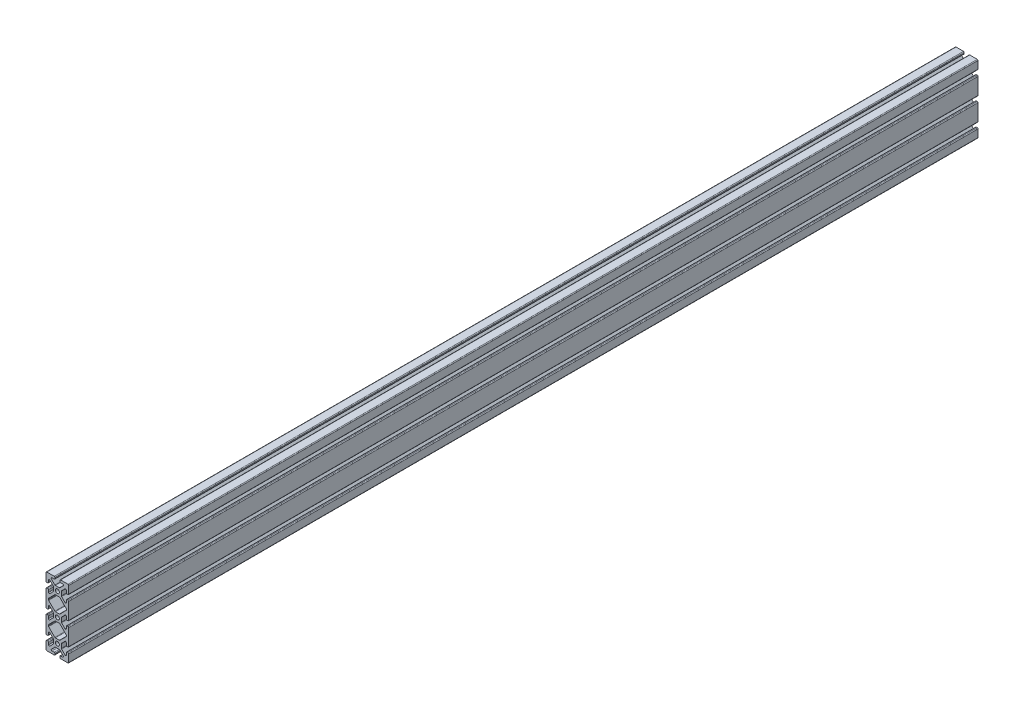
from build123d import *

# Parameters (mm, degrees)
SKETCH1_R           = 3.3274
BOSS_EXTRUDE1_DEPTH = 1524
FILLET1_R           = 1.27


with BuildPart() as part:
    # Sketch1 → Boss-Extrude1 (new body)
    with BuildSketch(Plane.XY):
        Polygon((-12.112318041, 14.986), (-3.882718041, 6.7564), (3.882718041, 6.7564), (12.112318041, 14.986), (4.064, 14.986), (4.064, 19.05), (19.05, 19.05), (19.05, 4.064), (14.986, 4.064), (14.986, 12.112318041), (6.7564, 3.882718041), (6.7564, -3.882718041), (14.986, -12.112318041), (14.986, -4.064), (19.05, -4.064), (19.05, -34.036), (14.986, -34.036), (14.986, -25.987681959), (6.7564, -34.217281959), (6.7564, -41.982718041), (14.986, -50.212318041), (14.986, -42.164), (19.05, -42.164), (19.05, -72.136), (14.986, -72.136), (14.986, -64.087681959), (6.7564, -72.317281959), (6.7564, -80.082718041), (14.986, -88.312318041), (14.986, -80.264), (19.05, -80.264), (19.05, -95.25), (4.064, -95.25), (4.064, -91.186), (12.112318041, -91.186), (3.882718041, -82.9564), (-3.882718041, -82.9564), (-12.112318041, -91.186), (-4.064, -91.186), (-4.064, -95.25), (-19.05, -95.25), (-19.05, -80.264), (-14.986, -80.264), (-14.986, -88.312318041), (-6.7564, -80.082718041), (-6.7564, -72.317281959), (-14.986, -64.087681959), (-14.986, -72.136), (-19.05, -72.136), (-19.05, -42.164), (-14.986, -42.164), (-14.986, -50.212318041), (-6.7564, -41.982718041), (-6.7564, -34.217281959), (-14.986, -25.987681959), (-14.986, -34.036), (-19.05, -34.036), (-19.05, -4.064), (-14.986, -4.064), (-14.986, -12.112318041), (-6.7564, -3.882718041), (-6.7564, 3.882718041), (-14.986, 12.112318041), (-14.986, 4.064), (-19.05, 4.064), (-19.05, 19.05), (-4.064, 19.05), (-4.064, 14.986), align=None)
        Circle(SKETCH1_R, mode=Mode.SUBTRACT)
        with Locations(Location((0, -38.1, 0), (0, 0, 180))):
            Circle(SKETCH1_R, mode=Mode.SUBTRACT)
        with Locations(Location((0, -76.2, 0), (0, 0, 180))):
            Circle(SKETCH1_R, mode=Mode.SUBTRACT)
        Polygon((-3.882718041, -6.7564), (-14.986, -17.859681959), (-14.986, -20.240318041), (-3.882718041, -31.3436), (3.882718041, -31.3436), (14.986, -20.240318041), (14.986, -17.859681959), (3.882718041, -6.7564), align=None, mode=Mode.SUBTRACT)
        Polygon((14.986, -58.340318041), (14.986, -55.959681959), (3.882718041, -44.8564), (-3.882718041, -44.8564), (-14.986, -55.959681959), (-14.986, -58.340318041), (-3.882718041, -69.4436), (3.882718041, -69.4436), align=None, mode=Mode.SUBTRACT)
    extrude(amount=BOSS_EXTRUDE1_DEPTH)

    # Fillet1
    fillet1_edges = [part.edges().sort_by_distance(p)[0] for p in [
        (-19.05, 19.05, 762),
        (-4.064, 19.05, 762),
        (-4.064, 14.986, 762),
        (-12.112318041, 14.986, 762),
        (-3.882718041, 6.7564, 762),
        (3.882718041, 6.7564, 762),
        (12.112318041, 14.986, 762),
        (4.064, 14.986, 762),
        (4.064, 19.05, 762),
        (19.05, 19.05, 762),
        (19.05, 4.064, 762),
        (14.986, 4.064, 762),
        (14.986, 12.112318041, 762),
        (6.7564, 3.882718041, 762),
        (6.7564, -3.882718041, 762),
        (14.986, -12.112318041, 762),
        (14.986, -4.064, 762),
        (19.05, -4.064, 762),
        (19.05, -34.036, 762),
        (14.986, -34.036, 762),
        (14.986, -25.987681959, 762),
        (6.7564, -34.217281959, 762),
        (6.7564, -41.982718041, 762),
        (14.986, -50.212318041, 762),
        (14.986, -42.164, 762),
        (19.05, -42.164, 762),
        (19.05, -72.136, 762),
        (14.986, -72.136, 762),
        (14.986, -64.087681959, 762),
        (6.7564, -72.317281959, 762),
        (6.7564, -80.082718041, 762),
        (14.986, -88.312318041, 762),
        (14.986, -80.264, 762),
        (19.05, -80.264, 762),
        (19.05, -95.25, 762),
        (4.064, -95.25, 762),
        (4.064, -91.186, 762),
        (12.112318041, -91.186, 762),
        (3.882718041, -82.9564, 762),
        (-3.882718041, -82.9564, 762),
        (-12.112318041, -91.186, 762),
        (-4.064, -91.186, 762),
        (-4.064, -95.25, 762),
        (-19.05, -95.25, 762),
        (-19.05, -80.264, 762),
        (-14.986, -80.264, 762),
        (-14.986, -88.312318041, 762),
        (-6.7564, -80.082718041, 762),
        (-6.7564, -72.317281959, 762),
        (-14.986, -64.087681959, 762),
        (-14.986, -72.136, 762),
        (-19.05, -72.136, 762),
        (-19.05, -42.164, 762),
        (-14.986, -42.164, 762),
        (-14.986, -50.212318041, 762),
        (-6.7564, -41.982718041, 762),
        (-6.7564, -34.217281959, 762),
        (-14.986, -25.987681959, 762),
        (-14.986, -34.036, 762),
        (-19.05, -34.036, 762),
        (-19.05, -4.064, 762),
        (-14.986, -4.064, 762),
        (-14.986, -12.112318041, 762),
        (-6.7564, -3.882718041, 762),
        (-6.7564, 3.882718041, 762),
        (-14.986, 12.112318041, 762),
        (-14.986, 4.064, 762),
        (-19.05, 4.064, 762),
        (14.986, -20.240318041, 762),
        (14.986, -17.859681959, 762),
        (3.882718041, -6.7564, 762),
        (-3.882718041, -6.7564, 762),
        (-14.986, -17.859681959, 762),
        (-14.986, -20.240318041, 762),
        (-3.882718041, -31.3436, 762),
        (3.882718041, -31.3436, 762),
        (3.882718041, -69.4436, 762),
        (14.986, -58.340318041, 762),
        (14.986, -55.959681959, 762),
        (3.882718041, -44.8564, 762),
        (-3.882718041, -44.8564, 762),
        (-14.986, -55.959681959, 762),
        (-14.986, -58.340318041, 762),
        (-3.882718041, -69.4436, 762),
    ]]
    fillet(fillet1_edges, radius=FILLET1_R)


solid = part.part
